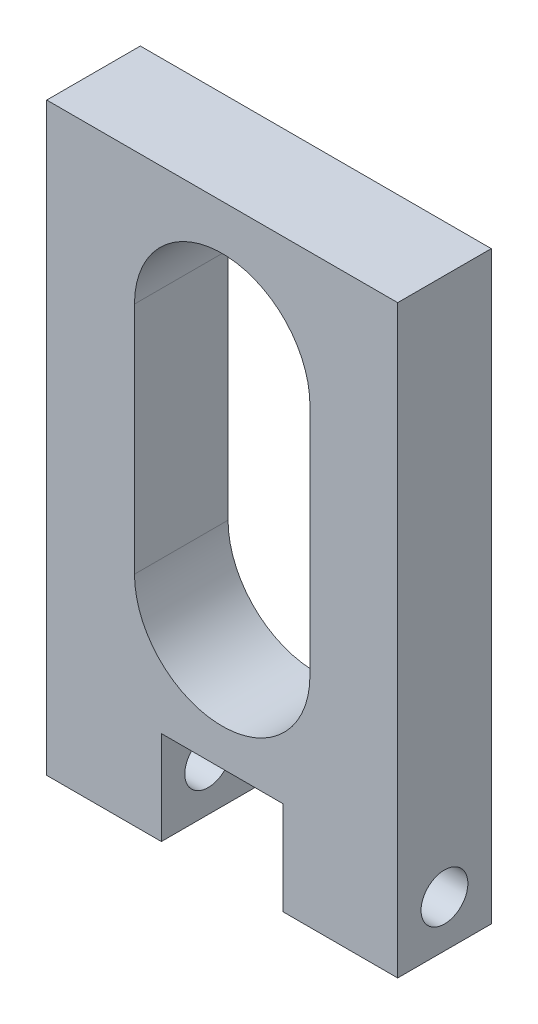
from build123d import *

# Parameters (mm, degrees)
BOSS_EXTRUDE2_DEPTH = 10.16
SKETCH4_R           = 2.54
CUT_EXTRUDE1_DEPTH  = 38.1


with BuildPart() as part:
    # Sketch1 → Boss-Extrude2 (new body)
    with BuildSketch(Plane.XY):
        Polygon((0, 0), (12.446, 0), (12.446, 10.16), (25.654, 10.16), (25.654, 0), (38.1, 0), (38.1, 63.5), (0, 63.5), align=None)
        with BuildLine():
            Line((9.525, 49.078456098), (9.525, 23.678456098))
            ThreePointArc((9.525, 23.678456098), (19.05, 14.153456098), (28.575, 23.678456098))
            Line((28.575, 23.678456098), (28.575, 49.078456098))
            ThreePointArc((28.575, 49.078456098), (19.05, 58.603456098), (9.525, 49.078456098))
        make_face(mode=Mode.SUBTRACT)
    extrude(amount=BOSS_EXTRUDE2_DEPTH)

    # Sketch4 → Cut-Extrude1 (cut)
    with BuildSketch(Plane.ZY):
        with Locations((5.08, 5.08)):
            Circle(SKETCH4_R)
    extrude(amount=-CUT_EXTRUDE1_DEPTH, mode=Mode.SUBTRACT)


solid = part.part
